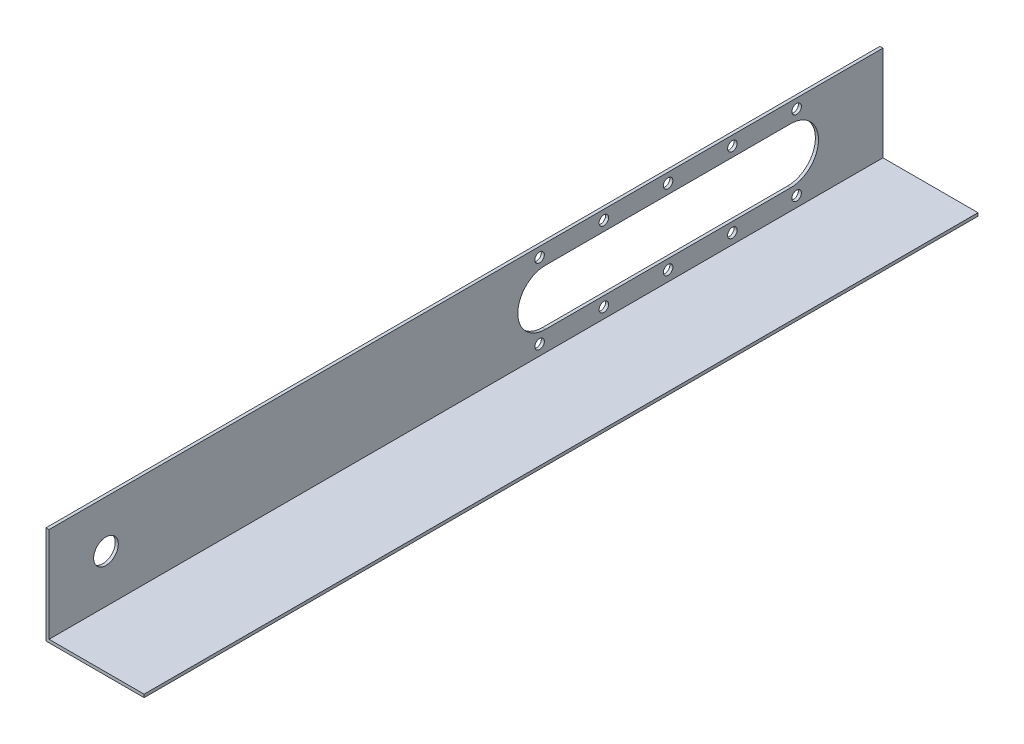
from build123d import *

# Parameters (mm, degrees)
BOSS_EXTRUDE2_DEPTH          = 431.8
CUT_EXTRUDE3_DEPTH           = 127
SKETCH7_R                    = 6.3881
CUT_EXTRUDE4_DEPTH           = 438.372816156
F_10_0_1935_DIAMETER_HOLE3_D = 4.9149


with BuildPart() as part:
    # Sketch3 → Boss-Extrude2 (new body)
    with BuildSketch(Plane.XY):
        Polygon((0, 0), (0, 49.2125), (-1.5875, 49.2125), (-1.5875, -1.5875), (49.2125, -1.5875), (49.2125, 0), align=None)
    extrude(amount=BOSS_EXTRUDE2_DEPTH)

    # Sketch6 → Cut-Extrude3 (cut)
    with BuildSketch(Plane(origin=(0, 0, 0), x_dir=(0, 0, -1), z_dir=(1, 0, 0))):
        with BuildLine():
            Line((-174.752, 39.1795), (-47.752, 39.1795))
            ThreePointArc((-47.752, 39.1795), (-33.401, 24.8285), (-47.752, 10.4775))
            Line((-47.752, 10.4775), (-174.752, 10.4775))
            ThreePointArc((-174.752, 10.4775), (-189.103, 24.8285), (-174.752, 39.1795))
        make_face()
    extrude(amount=-CUT_EXTRUDE3_DEPTH, mode=Mode.SUBTRACT)

    # Sketch7 → Cut-Extrude4 (cut, through all)
    with BuildSketch(Plane(origin=(0, 0, 0), x_dir=(0, 0, -1), z_dir=(1, 0, 0))):
        with Locations(Location((-402.336, 24.773594829, 0), (0, 0, 90))):
            Circle(SKETCH7_R)
    extrude(amount=-CUT_EXTRUDE4_DEPTH, mode=Mode.SUBTRACT)

    # #10 (0.1935) Diameter Hole3 (through all)
    with Locations(Plane(origin=(0, 0, 0), x_dir=(0, 0, -1), z_dir=(1, 0, 0))):
        with Locations((-177.8, 44.2595), (-144.526, 44.2595), (-111.252, 44.2595), (-177.8, 5.3975), (-144.526, 5.3975), (-111.252, 5.3975), (-77.978, 44.2595), (-44.704, 44.2595), (-44.704, 5.3975), (-77.978, 5.3975)):
            Hole(F_10_0_1935_DIAMETER_HOLE3_D / 2)


solid = part.part
